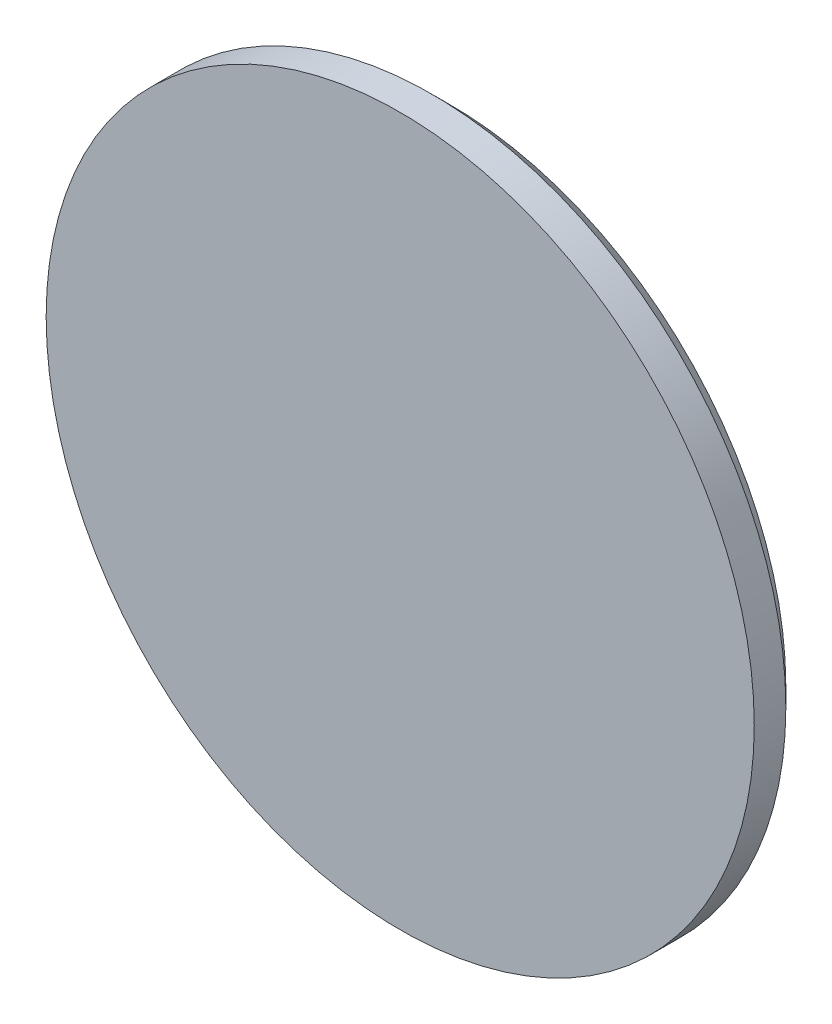
from build123d import *

# Parameters (mm, degrees)
SKETCH1_R           = 25
BOSS_EXTRUDE1_DEPTH = 3.5
CHAMFER1_SIZE       = 1.27


with BuildPart() as part:
    # Sketch1 → Boss-Extrude1 (new body)
    with BuildSketch(Plane.XY):
        with Locations((-33.203157923, 22.439496838)):
            Circle(SKETCH1_R)
    extrude(amount=BOSS_EXTRUDE1_DEPTH)

    # Chamfer1
    chamfer1_edges = [part.edges().sort_by_distance(p)[0] for p in [
        (-58.203157923, 22.439496838, 0),
    ]]
    chamfer(chamfer1_edges, length=CHAMFER1_SIZE)


solid = part.part
